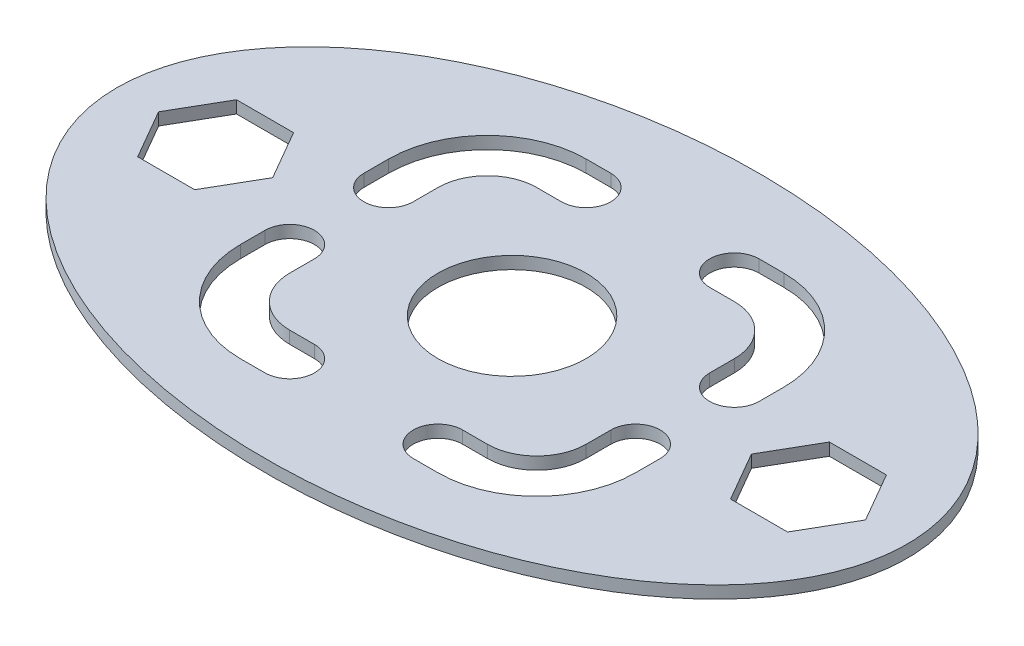
from build123d import *

# Parameters (mm, degrees)
SKETCH1_RX          = 101.6
SKETCH1_RY          = 63.5
SKETCH1_R           = 19.05
BOSS_EXTRUDE1_DEPTH = 3.175


with BuildPart() as part:
    # Sketch1 → Boss-Extrude1 (new body)
    with BuildSketch(Plane(origin=(0, 0, 0), x_dir=(1, 0, 0), z_dir=(0, 1, 0))):
        with Locations(Location((0, 0), (0, 0, 180))):
            Ellipse(SKETCH1_RX, SKETCH1_RY)
        with Locations(Location((0, 0, 0), (0, 0, 270))):
            Circle(SKETCH1_R, mode=Mode.SUBTRACT)
        Polygon((-61.535303163, 0), (-68.867651581, 12.7), (-83.532348419, 12.7), (-90.864696837, 0), (-83.532348419, -12.7), (-68.867651581, -12.7), align=None, mode=Mode.SUBTRACT)
        Polygon((90.864696837, 0), (83.532348419, 12.7), (68.867651581, 12.7), (61.535303163, 0), (68.867651581, -12.7), (83.532348419, -12.7), align=None, mode=Mode.SUBTRACT)
        with BuildLine():
            Line((50.8, -19.05), (50.8, -12.7))
            ThreePointArc((50.8, -12.7), (44.45, -6.35), (38.1, -12.7))
            Line((38.1, -12.7), (38.1, -19.05))
            ThreePointArc((38.1, -19.05), (34.380256121, -28.030256121), (25.4, -31.75))
            Line((25.4, -31.75), (19.05, -31.75))
            ThreePointArc((19.05, -31.75), (12.7, -38.1), (19.05, -44.45))
            Line((19.05, -44.45), (25.4, -44.45))
            ThreePointArc((25.4, -44.45), (43.360512242, -37.010512242), (50.8, -19.05))
        make_face(mode=Mode.SUBTRACT)
        with BuildLine():
            Line((-25.4, -31.75), (-19.05, -31.75))
            ThreePointArc((-19.05, -31.75), (-12.7, -38.1), (-19.05, -44.45))
            Line((-19.05, -44.45), (-25.4, -44.45))
            ThreePointArc((-25.4, -44.45), (-43.360512242, -37.010512242), (-50.8, -19.05))
            Line((-50.8, -19.05), (-50.8, -12.7))
            ThreePointArc((-50.8, -12.7), (-44.45, -6.35), (-38.1, -12.7))
            Line((-38.1, -12.7), (-38.1, -19.05))
            ThreePointArc((-38.1, -19.05), (-34.380256121, -28.030256121), (-25.4, -31.75))
        make_face(mode=Mode.SUBTRACT)
        with BuildLine():
            Line((25.4, 31.75), (19.05, 31.75))
            ThreePointArc((19.05, 31.75), (12.7, 38.1), (19.05, 44.45))
            Line((19.05, 44.45), (25.4, 44.45))
            ThreePointArc((25.4, 44.45), (43.360512242, 37.010512242), (50.8, 19.05))
            Line((50.8, 19.05), (50.8, 12.7))
            ThreePointArc((50.8, 12.7), (44.45, 6.35), (38.1, 12.7))
            Line((38.1, 12.7), (38.1, 19.05))
            ThreePointArc((38.1, 19.05), (34.380256121, 28.030256121), (25.4, 31.75))
        make_face(mode=Mode.SUBTRACT)
        with BuildLine():
            Line((-25.4, 31.75), (-19.05, 31.75))
            ThreePointArc((-19.05, 31.75), (-12.7, 38.1), (-19.05, 44.45))
            Line((-19.05, 44.45), (-25.4, 44.45))
            ThreePointArc((-25.4, 44.45), (-43.360512242, 37.010512242), (-50.8, 19.05))
            Line((-50.8, 19.05), (-50.8, 12.7))
            ThreePointArc((-50.8, 12.7), (-44.45, 6.35), (-38.1, 12.7))
            Line((-38.1, 12.7), (-38.1, 19.05))
            ThreePointArc((-38.1, 19.05), (-34.380256121, 28.030256121), (-25.4, 31.75))
        make_face(mode=Mode.SUBTRACT)
    extrude(amount=BOSS_EXTRUDE1_DEPTH)


solid = part.part
